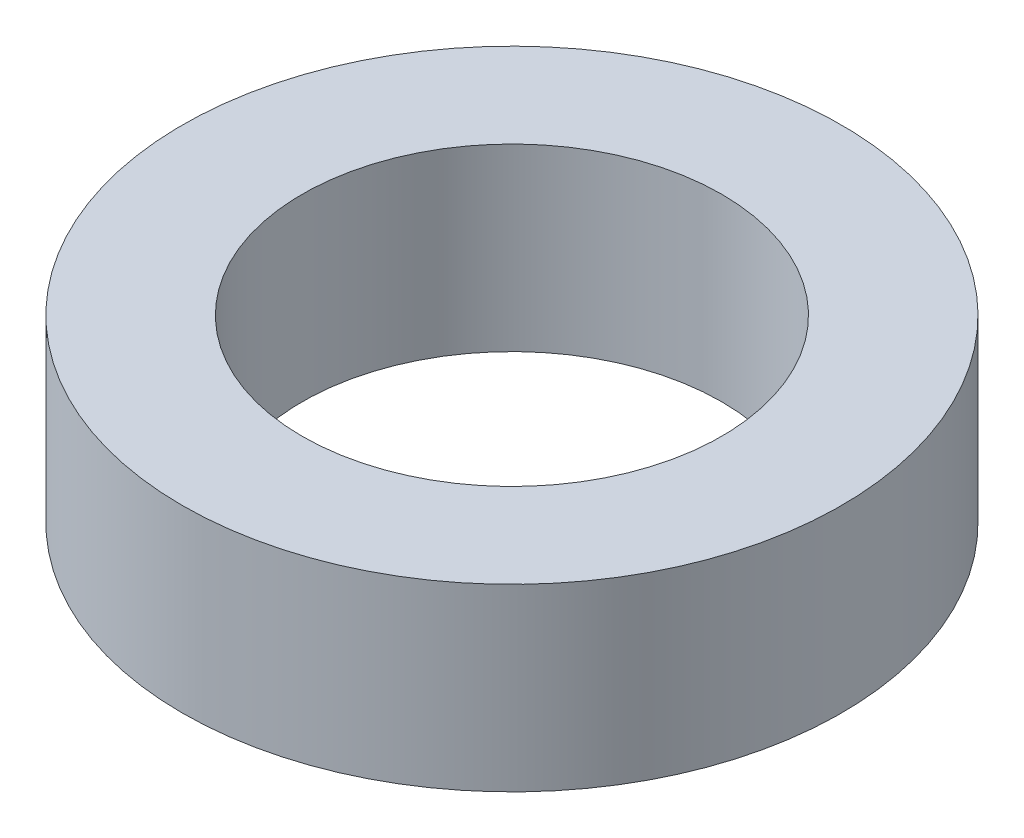
from build123d import *

# Parameters (mm, degrees)
SKETCH_1_R      = 5.5
SKETCH_1_R_2    = 3.5
EXTRUDE_1_DEPTH = 3


with BuildPart() as part:
    # 草图1 → 凸台-拉伸1 (new body)
    with BuildSketch(Plane(origin=(0, 0, 0), x_dir=(1, 0, 0), z_dir=(0, 1, 0))):
        with Locations(Location((0, 0, 0), (0, 0, 270))):
            Circle(SKETCH_1_R)
        with Locations(Location((0, 0, 0), (0, 0, 270))):
            Circle(SKETCH_1_R_2, mode=Mode.SUBTRACT)
    extrude(amount=EXTRUDE_1_DEPTH)


solid = part.part
